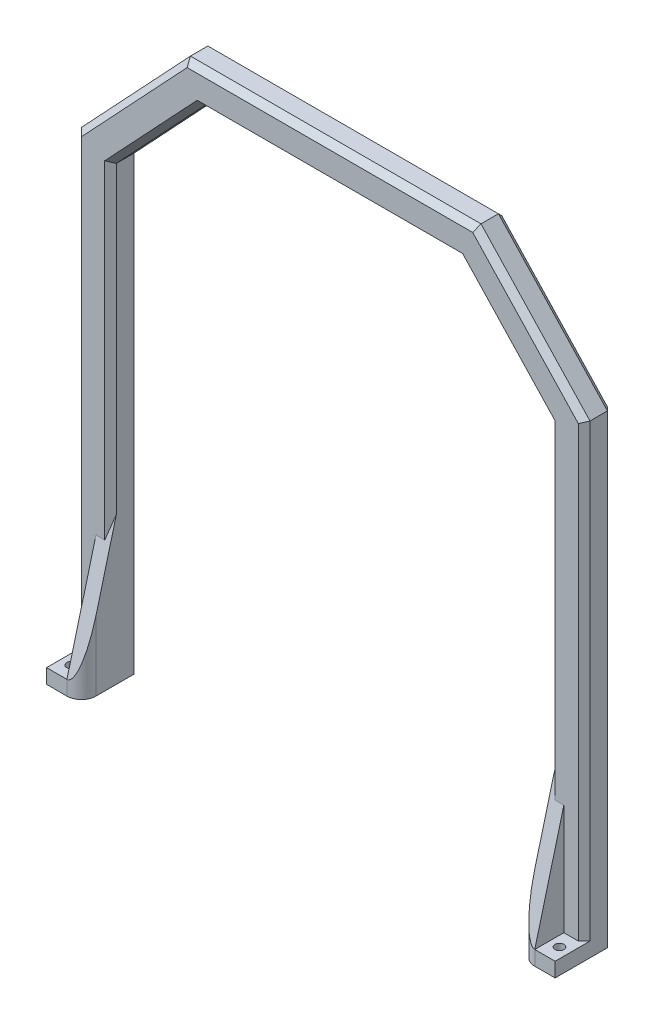
from build123d import *

# Parameters (mm, degrees)
BOSS_EXTRUDE1_DEPTH      = 5
BOSS_EXTRUDE1_DEPTH_BACK = 5
BOSS_EXTRUDE2_DEPTH      = 10
CUT_EXTRUDE1_DEPTH       = 262.627597933
SKETCH4_R                = 1.553741305
CUT_EXTRUDE2_DEPTH       = 215.257438611
CHAMFER1_SIZE            = 2
CHAMFER2_SIZE            = 2
FILLET1_R                = 5


with BuildPart() as part:
    # Sketch1 → Boss-Extrude1 (new, two sides: drawn at the far end of the back side and taken through both)
    with BuildSketch(Plane.XY.offset(-BOSS_EXTRUDE1_DEPTH_BACK)):
        Polygon((-87.5, -200), (-87.5, -40), (-50, 0), (50, 0), (87.5, -40), (87.5, -200), (75.5, -200), (75.5, -44.74536976), (44.80121585, -12), (-44.80121585, -12), (-75.5, -44.74536976), (-75.5, -200), align=None)
    extrude(amount=BOSS_EXTRUDE1_DEPTH + BOSS_EXTRUDE1_DEPTH_BACK)

    # Sketch2 → Boss-Extrude2 (add)
    with BuildSketch(Plane.XY.offset(5)):
        Polygon((-87.5, -200), (-75.5, -200), (-75.5, -197), (-75.5, -157), (-80.5, -157), (-80.5, -195), (-87.5, -195), align=None)
    boss_extrude2 = extrude(amount=BOSS_EXTRUDE2_DEPTH)

    # Sketch3 → Cut-Extrude1 (cut, through all)
    with BuildSketch(Plane.ZY.offset(80.5)):
        Polygon((5, -157), (15, -195), (15, -157), align=None)
    cut_extrude1 = extrude(amount=-CUT_EXTRUDE1_DEPTH, mode=Mode.SUBTRACT)

    # Sketch4 → Cut-Extrude2 (cut, through all)
    with BuildSketch(Plane(origin=(0, -195, 0), x_dir=(1, 0, 0), z_dir=(0, 1, 0))):
        with Locations((-84, -10)):
            Circle(SKETCH4_R)
    cut_extrude2 = extrude(amount=-CUT_EXTRUDE2_DEPTH, mode=Mode.SUBTRACT)

    # Mirror1: Boss-Extrude2, Cut-Extrude1, Cut-Extrude2 across plane
    add(boss_extrude2.mirror(Plane(origin=(0, 0, 0), x_dir=(0, 0, 1), z_dir=(1, 0, 0))))
    add(cut_extrude1.mirror(Plane(origin=(0, 0, 0), x_dir=(0, 0, 1), z_dir=(1, 0, 0))), mode=Mode.SUBTRACT)
    add(cut_extrude2.mirror(Plane(origin=(0, 0, 0), x_dir=(0, 0, 1), z_dir=(1, 0, 0))), mode=Mode.SUBTRACT)

    # Chamfer1
    chamfer1_edges = [part.edges().sort_by_distance(p)[0] for p in [
        (-75.5, -122.37268488, -5),
        (-60.150607925, -28.37268488, -5),
        (0, -12, -5),
        (60.150607925, -28.37268488, -5),
        (75.5, -122.37268488, -5),
        (81.5, -200, -5),
        (87.5, -120, -5),
        (68.75, -20, -5),
        (0, 0, -5),
        (-68.75, -20, -5),
        (-87.5, -120, -5),
        (-81.5, -200, -5),
    ]]
    chamfer(chamfer1_edges, length=CHAMFER1_SIZE)

    # Chamfer2
    chamfer2_edges = [part.edges().sort_by_distance(p)[0] for p in [
        (75.5, -100.87268488, 5),
        (60.150607925, -28.37268488, 5),
        (0, -12, 5),
        (-75.5, -100.87268488, 5),
        (-60.150607925, -28.37268488, 5),
        (87.5, -117.5, 5),
        (68.75, -20, 5),
        (0, 0, 5),
        (-68.75, -20, 5),
        (-87.5, -117.5, 5),
    ]]
    chamfer(chamfer2_edges, length=CHAMFER2_SIZE)

    # Fillet1
    fillet1_edges = [part.edges().sort_by_distance(p)[0] for p in [
        (75.5, -197.5, 15),
        (-75.5, -197.5, 15),
    ]]
    fillet(fillet1_edges, radius=FILLET1_R)


solid = part.part
